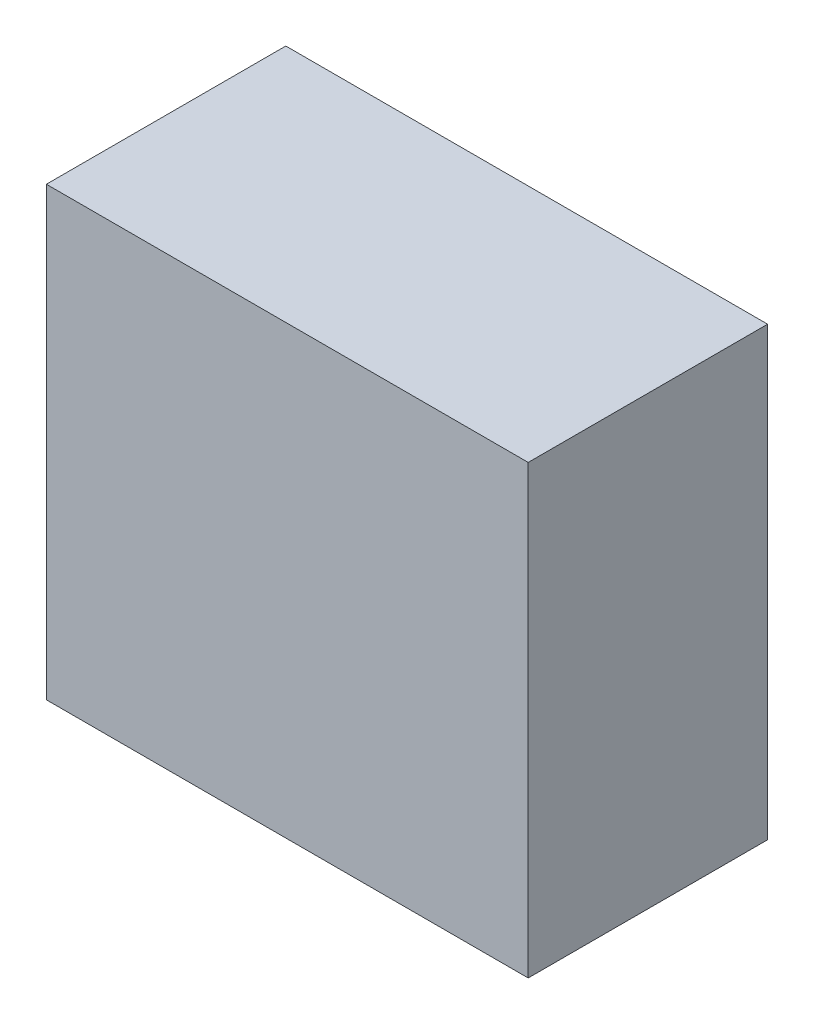
from build123d import *

# Parameters (mm, degrees)
SKETCH1_W           = 40.25
SKETCH1_H           = 37.3
BOSS_EXTRUDE1_DEPTH = 20


with BuildPart() as part:
    # Sketch1 → Boss-Extrude1 (new body)
    with BuildSketch(Plane.XY.offset(10)):
        with Locations((0, 18.65)):
            Rectangle(SKETCH1_W, SKETCH1_H)
    extrude(amount=-BOSS_EXTRUDE1_DEPTH)


solid = part.part
